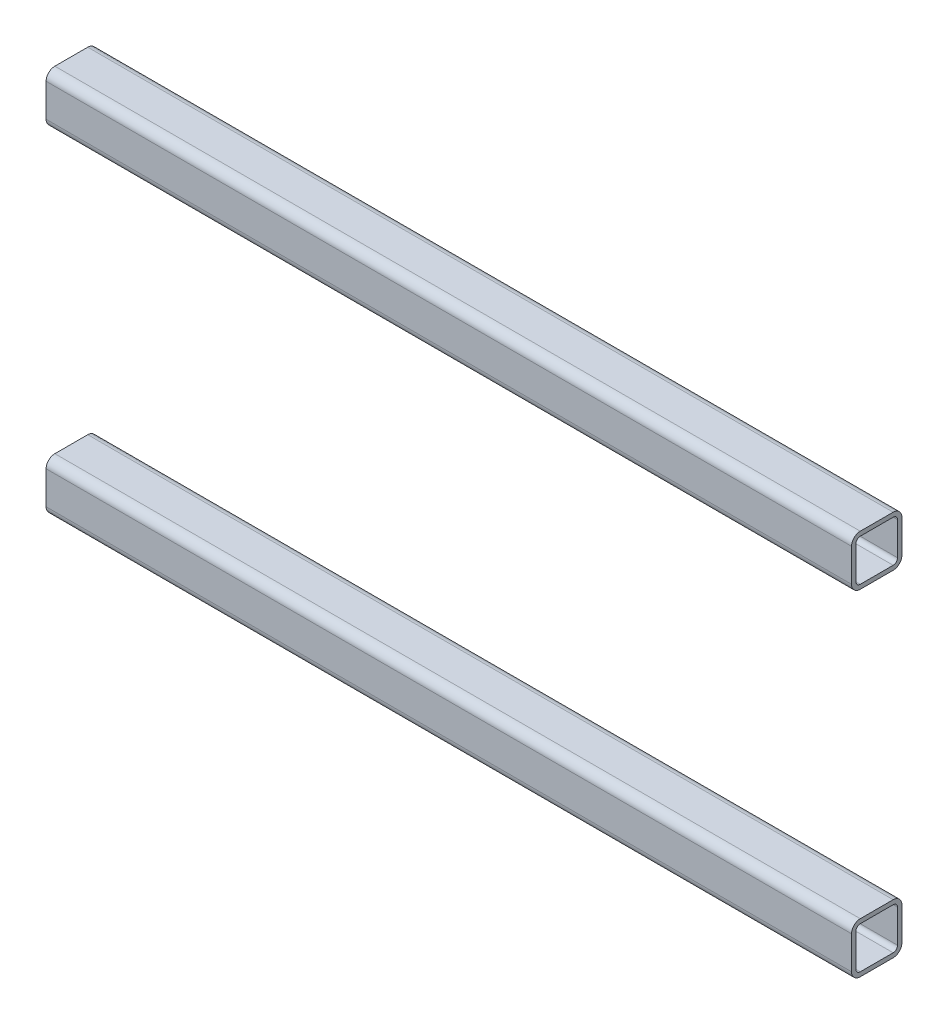
from build123d import *

# Parameters (mm, degrees)
SQUARE_TUBE_CONFIGURED_30_X_30_X_2_6_1_DEPTH = 480
SQUARE_TUBE_CONFIGURED_30_X_30_X_2_2_DEPTH   = 480


with BuildPart() as part:
    # Sketch1 → Square tube - configured 30 X 30 X 2.6(1) (new body)
    with BuildSketch(Plane(origin=(0, 200, 0), x_dir=(0, 0, -1), z_dir=(1, 0, 0))):
        with BuildLine():
            Line((-9.8, -15), (9.8, -15))
            ThreePointArc((9.8, -15), (13.476955262, -13.476955262), (15, -9.8))
            Line((15, -9.8), (15, 9.8))
            ThreePointArc((15, 9.8), (13.476955262, 13.476955262), (9.8, 15))
            Line((9.8, 15), (-9.8, 15))
            ThreePointArc((-9.8, 15), (-13.476955262, 13.476955262), (-15, 9.8))
            Line((-15, 9.8), (-15, -9.8))
            ThreePointArc((-15, -9.8), (-13.476955262, -13.476955262), (-9.8, -15))
        make_face()
        with BuildLine():
            Line((-9.8, -12.4), (9.8, -12.4))
            ThreePointArc((9.8, -12.4), (11.638477631, -11.638477631), (12.4, -9.8))
            Line((12.4, -9.8), (12.4, 9.8))
            ThreePointArc((12.4, 9.8), (11.638477631, 11.638477631), (9.8, 12.4))
            Line((9.8, 12.4), (-9.8, 12.4))
            ThreePointArc((-9.8, 12.4), (-11.638477631, 11.638477631), (-12.4, 9.8))
            Line((-12.4, 9.8), (-12.4, -9.8))
            ThreePointArc((-12.4, -9.8), (-11.638477631, -11.638477631), (-9.8, -12.4))
        make_face(mode=Mode.SUBTRACT)
    extrude(amount=SQUARE_TUBE_CONFIGURED_30_X_30_X_2_6_1_DEPTH)


with BuildPart() as body_2:
    # Sketch1 on segment 2 (carried to segment 2) → Square tube - configured 30 X 30 X 2 2 (new body)
    with BuildSketch(Plane(origin=(0, 0, 0), x_dir=(0, 0, -1), z_dir=(1, 0, 0))):
        with BuildLine():
            Line((-9.8, -15), (9.8, -15))
            ThreePointArc((9.8, -15), (13.476955262, -13.476955262), (15, -9.8))
            Line((15, -9.8), (15, 9.8))
            ThreePointArc((15, 9.8), (13.476955262, 13.476955262), (9.8, 15))
            Line((9.8, 15), (-9.8, 15))
            ThreePointArc((-9.8, 15), (-13.476955262, 13.476955262), (-15, 9.8))
            Line((-15, 9.8), (-15, -9.8))
            ThreePointArc((-15, -9.8), (-13.476955262, -13.476955262), (-9.8, -15))
        make_face()
        with BuildLine():
            Line((-9.8, -12.4), (9.8, -12.4))
            ThreePointArc((9.8, -12.4), (11.638477631, -11.638477631), (12.4, -9.8))
            Line((12.4, -9.8), (12.4, 9.8))
            ThreePointArc((12.4, 9.8), (11.638477631, 11.638477631), (9.8, 12.4))
            Line((9.8, 12.4), (-9.8, 12.4))
            ThreePointArc((-9.8, 12.4), (-11.638477631, 11.638477631), (-12.4, 9.8))
            Line((-12.4, 9.8), (-12.4, -9.8))
            ThreePointArc((-12.4, -9.8), (-11.638477631, -11.638477631), (-9.8, -12.4))
        make_face(mode=Mode.SUBTRACT)
    extrude(amount=SQUARE_TUBE_CONFIGURED_30_X_30_X_2_2_DEPTH)


solid = Compound([part.part, body_2.part])
